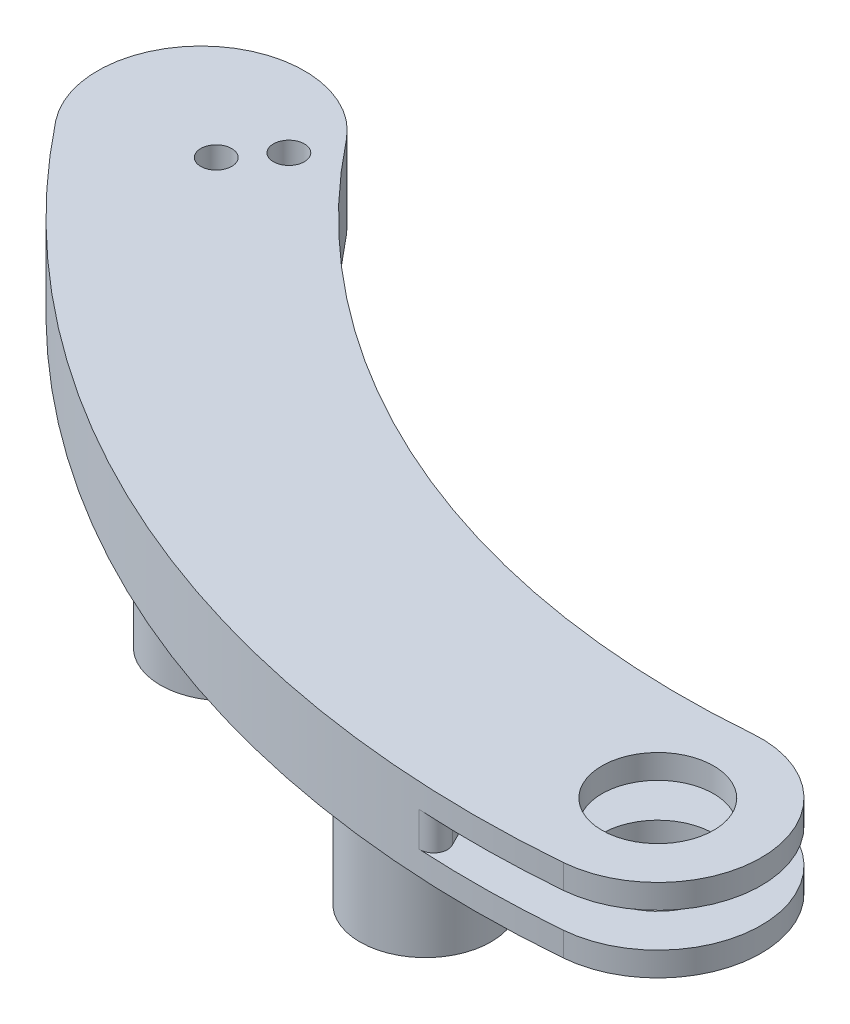
from build123d import *

# Parameters (mm, degrees)
BOSS_EXTRUDE4_DEPTH = 11.999999999999996
BOSS_EXTRUDE5_DEPTH = 3.5
BOSS_EXTRUDE6_DEPTH = 12
CUT_EXTRUDE2_DEPTH  = 8.5
BOSS_EXTRUDE7_DEPTH = 3.5000000000000004
SKETCH2_R           = 8.1
CUT_EXTRUDE3_DEPTH  = 12
FILLET1_R           = 5
FILLET2_R           = 2
SKETCH3_R           = 2.2499999999999964
CUT_EXTRUDE4_DEPTH  = 12
SKETCH4_R           = 9.500000000000002
SKETCH4_R_2         = 8.1
SKETCH4_R_3         = 9.499999999999995
SKETCH4_R_4         = 8.099999999999993
BOSS_EXTRUDE8_DEPTH = 19.999999999999993


with BuildPart() as part:
    # Sketch1 → Boss-Extrude4 (new body)
    with BuildSketch(Plane(origin=(0, 0, 0), x_dir=(1, 0, 0), z_dir=(0, 1, 0))):
        with BuildLine():
            ThreePointArc((-105.23956914411866, 60.05130546378884), (-126.31086817026393, 62.500868149406244), (-128.76043085588134, 41.429569123260976))
            ThreePointArc((-128.76043085588134, 41.42956912326096), (-78.3921989201775, 0.4513014224205847), (-15.424890802752289, -15.400995588922257))
            ThreePointArc((-15.424890802752284, -15.400995588922251), (-20.878753235246265, -0.5691494549701637), (-16.67921047602729, 14.665420305521598))
            ThreePointArc((-16.679210476027265, 14.665420305521593), (-65.8857769449076, 27.74562513419724), (-105.23956914411866, 60.05130546378885))
        make_face()
    extrude(amount=BOSS_EXTRUDE4_DEPTH)

    # Sketch1<6> → Boss-Extrude5 (add)
    with BuildSketch(Plane(origin=(0, 0, 0), x_dir=(1, 0, 0), z_dir=(0, 1, 0))):
        with BuildLine():
            ThreePointArc((-16.67921047602729, 14.665420305521598), (-20.878753235246265, -0.5691494549701637), (-15.424890802752284, -15.400995588922251))
            ThreePointArc((-15.424890802752289, -15.400995588922257), (-7.086372530747029, -15.406529466177687), (1.2395691441186596, -14.94869453621115))
            ThreePointArc((1.2395691441186607, -14.948694536211157), (14.948694536211152, 1.2395691441186514), (-1.2395691441186483, 14.948694536211152))
            ThreePointArc((-1.2395691441186347, 14.94869453621115), (-8.954828429393212, 14.55844291928571), (-16.679210476027265, 14.665420305521593))
        make_face()
    extrude(amount=BOSS_EXTRUDE5_DEPTH)

    # Sketch1<8> → Boss-Extrude6 (add)
    with BuildSketch(Plane(origin=(0, 0, 0), x_dir=(1, 0, 0), z_dir=(0, 1, 0))):
        with BuildLine():
            ThreePointArc((-16.67921047602729, 14.665420305521598), (-20.878753235246265, -0.5691494549701637), (-15.424890802752284, -15.400995588922251))
            ThreePointArc((-15.424890802752289, -15.400995588922257), (-7.086372530747029, -15.406529466177687), (1.2395691441186596, -14.94869453621115))
            ThreePointArc((1.2395691441186607, -14.948694536211157), (14.948694536211152, 1.2395691441186514), (-1.2395691441186483, 14.948694536211152))
            ThreePointArc((-1.2395691441186347, 14.94869453621115), (-8.954828429393212, 14.55844291928571), (-16.679210476027265, 14.665420305521593))
        make_face()
    extrude(amount=BOSS_EXTRUDE6_DEPTH)

    # Sketch1<9> → Cut-Extrude2 (cut)
    with BuildSketch(Plane(origin=(0, 0, 0), x_dir=(1, 0, 0), z_dir=(0, 1, 0))):
        with BuildLine():
            ThreePointArc((-16.67921047602729, 14.665420305521598), (-20.878753235246265, -0.5691494549701637), (-15.424890802752284, -15.400995588922251))
            ThreePointArc((-15.424890802752289, -15.400995588922257), (-7.086372530747029, -15.406529466177687), (1.2395691441186596, -14.94869453621115))
            ThreePointArc((1.2395691441186607, -14.948694536211157), (14.948694536211152, 1.2395691441186514), (-1.2395691441186483, 14.948694536211152))
            ThreePointArc((-1.2395691441186347, 14.94869453621115), (-8.954828429393212, 14.55844291928571), (-16.679210476027265, 14.665420305521593))
        make_face()
    extrude(amount=CUT_EXTRUDE2_DEPTH, mode=Mode.SUBTRACT)

    # Sketch1<10> → Boss-Extrude7 (add)
    with BuildSketch(Plane(origin=(0, 0, 0), x_dir=(1, 0, 0), z_dir=(0, 1, 0))):
        with BuildLine():
            ThreePointArc((-16.67921047602729, 14.665420305521598), (-20.878753235246265, -0.5691494549701637), (-15.424890802752284, -15.400995588922251))
            ThreePointArc((-15.424890802752289, -15.400995588922257), (-7.086372530747029, -15.406529466177687), (1.2395691441186596, -14.94869453621115))
            ThreePointArc((1.2395691441186607, -14.948694536211157), (14.948694536211152, 1.2395691441186514), (-1.2395691441186483, 14.948694536211152))
            ThreePointArc((-1.2395691441186347, 14.94869453621115), (-8.954828429393212, 14.55844291928571), (-16.679210476027265, 14.665420305521593))
        make_face()
    extrude(amount=BOSS_EXTRUDE7_DEPTH)

    # Sketch2 → Cut-Extrude3 (cut)
    with BuildSketch(Plane(origin=(0, 11.999999999999996, 0), x_dir=(1, 0, 0), z_dir=(0, 1, 0))):
        Circle(SKETCH2_R)
    extrude(amount=-CUT_EXTRUDE3_DEPTH, mode=Mode.SUBTRACT)

    # Fillet1
    fillet1_edges = [part.edges().sort_by_distance(p)[0] for p in [
        (-16.67921047602728, 6, -14.665420305521597),
    ]]
    fillet(fillet1_edges, radius=FILLET1_R)

    # Fillet2
    fillet2_edges = [part.edges().sort_by_distance(p)[0] for p in [
        (-15.424890802752289, 6, 15.400995588922266),
    ]]
    fillet(fillet2_edges, radius=FILLET2_R)

    # Sketch3 → Cut-Extrude4 (cut)
    with BuildSketch(Plane(origin=(0, 11.999999999999996, 0), x_dir=(1, 0, 0), z_dir=(0, 1, 0))):
        with Locations((-107.81660725396851, 54.30249040498051)):
            Circle(SKETCH3_R)
        with Locations((-112.49908312253997, 48.44378579216329)):
            Circle(SKETCH3_R)
    extrude(amount=-CUT_EXTRUDE4_DEPTH, mode=Mode.SUBTRACT)

    # Sketch4 → Boss-Extrude8 (add)
    # profile 1 of 2: a face of its own
    with BuildSketch(Plane(origin=(0, 0, 0), x_dir=(1, 0, 0), z_dir=(0, 1, 0))):
        with Locations((-35.51993478051481, 1.811997227050931)):
            Circle(SKETCH4_R)
        with Locations((-35.51993478051481, 1.811997227050931)):
            Circle(SKETCH4_R_2, mode=Mode.SUBTRACT)
    # profile 2 of 2: a face of its own
    with BuildSketch(Plane(origin=(0, 0, 0), x_dir=(1, 0, 0), z_dir=(0, 1, 0))):
        with Locations((-82.24716798080135, 19.60428986869888)):
            Circle(SKETCH4_R_3)
        with Locations((-82.24716798080135, 19.60428986869888)):
            Circle(SKETCH4_R_4, mode=Mode.SUBTRACT)
    extrude(amount=-BOSS_EXTRUDE8_DEPTH)


solid = part.part
